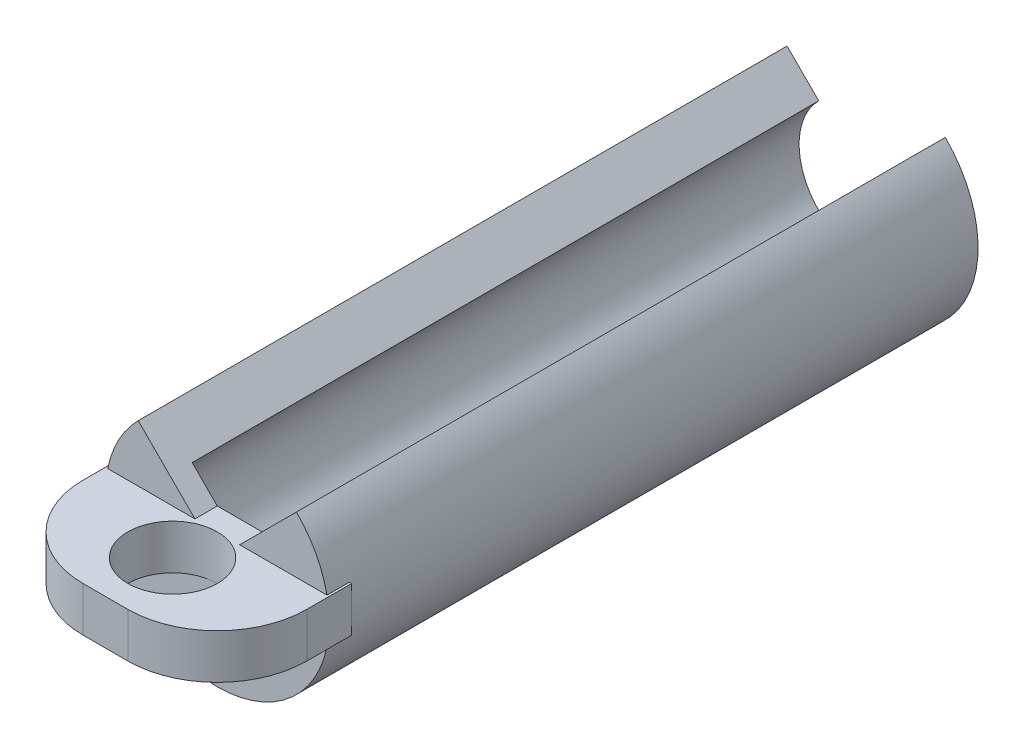
from build123d import *

# Parameters (mm, degrees)
SKETCH1_R                = 2
BOSS_EXTRUDE1_DEPTH      = 1
REVOLVE1_ANGLE           = 225
REVOLVE1_OTHER_WAY_ANGLE = 45


with BuildPart() as part:
    # Sketch1 → Boss-Extrude1 (new, symmetric)
    with BuildSketch(Plane(origin=(0, 0, 0), x_dir=(1, 0, 0), z_dir=(0, 1, 0))):
        with BuildLine():
            Line((-5, -29), (-5, -31))
            ThreePointArc((-5, -31), (-3.828427125, -33.828427125), (-1, -35))
            Line((-1, -35), (1, -35))
            ThreePointArc((1, -35), (3.828427125, -33.828427125), (5, -31))
            Line((5, -31), (5, -29))
            Line((5, -29), (-5, -29))
        make_face()
        with Locations((0, -32)):
            Circle(SKETCH1_R, mode=Mode.SUBTRACT)
    extrude(amount=BOSS_EXTRUDE1_DEPTH, both=True)

    # Sketch1<3> → Revolve1 (revolve)
    with BuildSketch(Plane(origin=(0, 0, 0), x_dir=(1, 0, 0), z_dir=(0, 1, 0))):
        Polygon((0, -30), (0, -29), (-3, -29), (-3, -1), (-5, -1), (-5, -30), align=None)
    revolve(axis=Axis((0, 0, 0), (0, 0, 1)), revolution_arc=REVOLVE1_ANGLE)

    # Sketch1<3> → Revolve1 other way (revolve)
    with BuildSketch(Plane(origin=(0, 0, 0), x_dir=(1, 0, 0), z_dir=(0, 1, 0))):
        Polygon((0, -30), (0, -29), (-3, -29), (-3, -1), (-5, -1), (-5, -30), align=None)
    revolve(axis=Axis((0, 0, 0), (0, 0, -1)), revolution_arc=REVOLVE1_OTHER_WAY_ANGLE)


solid = part.part
